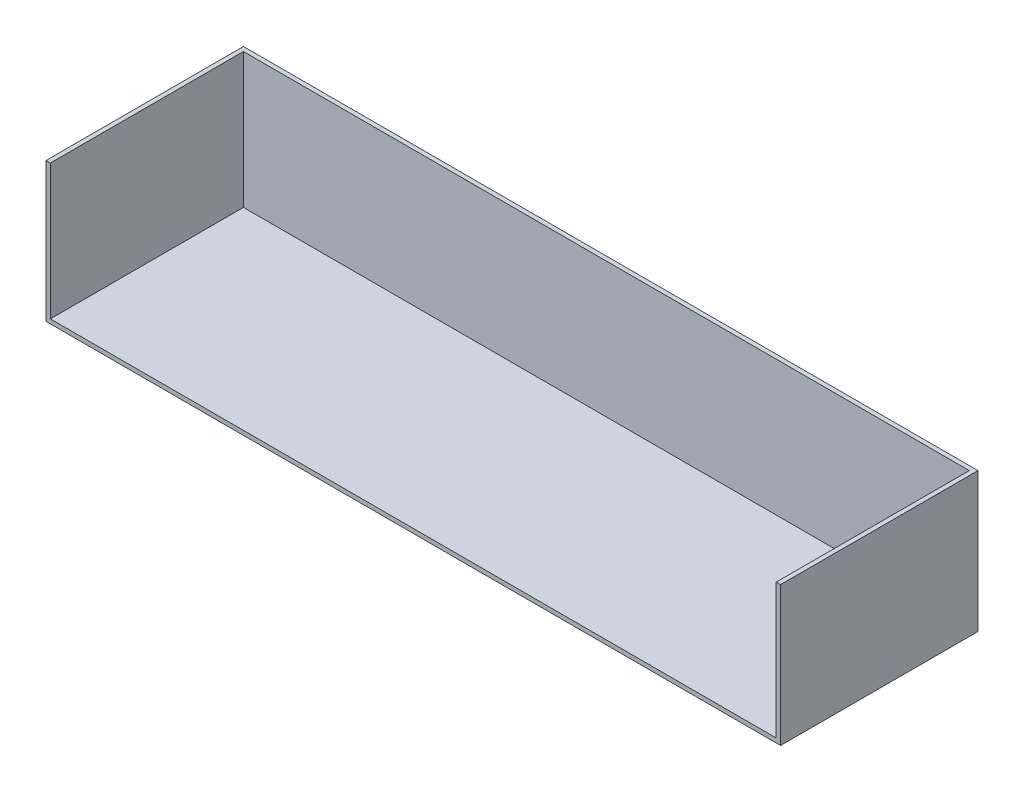
from build123d import *

# Parameters (mm, degrees)
SKETCH1_W           = 506
SKETCH1_H           = 136
BOSS_EXTRUDE1_DEPTH = 96
SHELL1_T            = -3
SKETCH3_W           = 500
SKETCH3_H           = 3
CUT_EXTRUDE2_DEPTH  = 93


with BuildPart() as part:
    # Sketch1 → Boss-Extrude1 (new body)
    with BuildSketch(Plane(origin=(0, 0, 0), x_dir=(1, 0, 0), z_dir=(0, 1, 0))):
        Rectangle(SKETCH1_W, SKETCH1_H)
    extrude(amount=BOSS_EXTRUDE1_DEPTH)

    # Shell1
    shell1_openings = [part.faces().sort_by_distance(p)[0] for p in [
        (0, 96, 0),
    ]]
    offset(amount=SHELL1_T, openings=shell1_openings, kind=Kind.INTERSECTION)

    # Sketch3 → Cut-Extrude2 (cut)
    with BuildSketch(Plane(origin=(0, 96, 0), x_dir=(1, 0, 0), z_dir=(0, 1, 0))):
        with Locations((0, -66.5)):
            Rectangle(SKETCH3_W, SKETCH3_H)
    extrude(amount=-CUT_EXTRUDE2_DEPTH, mode=Mode.SUBTRACT)


solid = part.part
